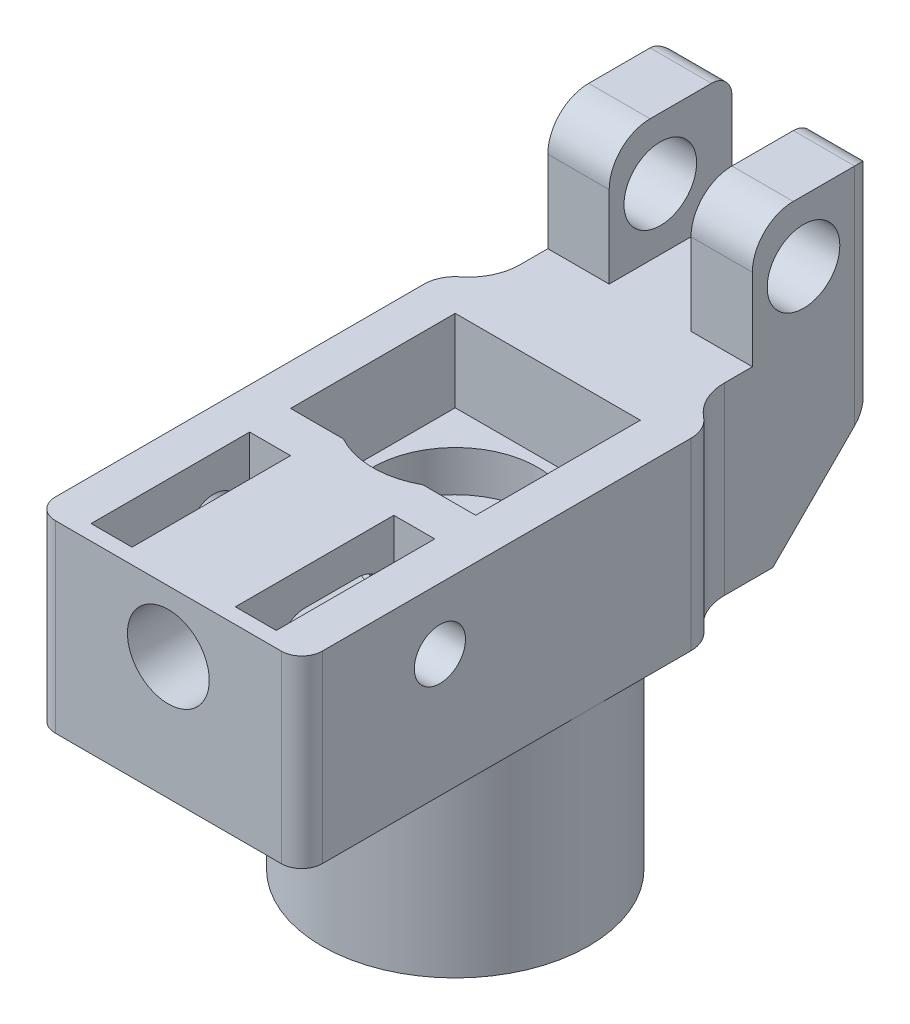
from build123d import *

# Parameters (mm, degrees)
SKETCH1_R               = 13.05
SKETCH1_R_2             = 8.05
BOSS_EXTRUDE1_DEPTH     = 20
SKETCH2_R               = 8.05
BOSS_EXTRUDE2_DEPTH     = 10
SKETCH3_W               = 18.1
SKETCH3_H               = 13
CUT_EXTRUDE1_DEPTH      = 4
SKETCH4_W               = 18.1
SKETCH4_H               = 13
BOSS_EXTRUDE3_DEPTH     = 8
SKETCH5_R               = 8.05
SKETCH5_R_2             = 4
BOSS_EXTRUDE4_DEPTH     = 6
SKETCH10_W              = 10.1
SKETCH10_H              = 13
BOSS_EXTRUDE7_DEPTH     = 12
CUT_EXTRUDE2_REACH      = 59.476
SKETCH6_R               = 4
CUT_EXTRUDE3_DEPTH      = 54.963066195
CUT_EXTRUDE3_DEPTH_BACK = 54.963066195
SKETCH7_R               = 2.5
BOSS_EXTRUDE5_DEPTH     = 10
SKETCH13_W              = 6
SKETCH13_H              = 12
BOSS_EXTRUDE8_DEPTH     = 12
FILLET1_R               = 5
FILLET2_R               = 2
CUT_EXTRUDE4_REACH      = 63.577
CUT_EXTRUDE5_REACH      = 65.209
SKETCH14_R              = 3.55
FILLET4_R               = 4
FILLET5_R               = 2
SKETCH15_W              = 4
SKETCH15_H              = 2.5
CUT_EXTRUDE6_DEPTH      = 12


with BuildPart() as part:
    # Sketch1 → Boss-Extrude1 (new body)
    with BuildSketch(Plane(origin=(0, 0, 0), x_dir=(1, 0, 0), z_dir=(0, 1, 0))):
        with Locations(Location((0, 0, 0), (0, 0, 270))):
            Circle(SKETCH1_R)
        with Locations(Location((0, 0, 0), (0, 0, 270))):
            Circle(SKETCH1_R_2, mode=Mode.SUBTRACT)
    extrude(amount=BOSS_EXTRUDE1_DEPTH)

    # Sketch2 → Boss-Extrude2 (add)
    with BuildSketch(Plane(origin=(0, 20, 0), x_dir=(1, 0, 0), z_dir=(0, 1, 0))):
        with BuildLine():
            Line((-13.05, -13.05), (-13.05, 10))
            ThreePointArc((-13.05, 10), (-12.156675683, 12.156675683), (-10, 13.05))
            Line((-10, 13.05), (10, 13.05))
            ThreePointArc((10, 13.05), (12.156675683, 12.156675683), (13.05, 10))
            Line((13.05, 10), (13.05, -13.05))
            Line((13.05, -13.05), (13.05, -28.05))
            Line((13.05, -28.05), (-13.05, -28.05))
            Line((-13.05, -28.05), (-13.05, -13.05))
        make_face()
        with Locations(Location((0, 0, 0), (0, 0, 270))):
            Circle(SKETCH2_R, mode=Mode.SUBTRACT)
    extrude(amount=BOSS_EXTRUDE2_DEPTH)

    # Sketch3 → Cut-Extrude1 (cut)
    with BuildSketch(Plane(origin=(0, 30, 0), x_dir=(1, 0, 0), z_dir=(0, 1, 0))):
        with Locations((0, -17.55)):
            Rectangle(SKETCH3_W, SKETCH3_H)
    extrude(amount=-CUT_EXTRUDE1_DEPTH, mode=Mode.SUBTRACT)

    # Sketch4 → Boss-Extrude3 (add)
    with BuildSketch(Plane(origin=(0, 30, 0), x_dir=(1, 0, 0), z_dir=(0, 1, 0))):
        with BuildLine():
            Line((-13.05, -28.05), (13.05, -28.05))
            Line((13.05, -28.05), (13.05, 10))
            ThreePointArc((13.05, 10), (12.156675683, 12.156675683), (10, 13.05))
            Line((10, 13.05), (-10, 13.05))
            ThreePointArc((-10, 13.05), (-12.156675683, 12.156675683), (-13.05, 10))
            Line((-13.05, 10), (-13.05, -28.05))
        make_face()
        with BuildLine():
            Line((-9.05, 9.05), (-9.05, -7.05))
            Line((-9.05, -7.05), (-3.885871846, -7.05))
            ThreePointArc((-3.885871846, -7.05), (0, -8.05), (3.885871846, -7.05))
            Line((3.885871846, -7.05), (9.05, -7.05))
            Line((9.05, -7.05), (9.05, 9.05))
            Line((9.05, 9.05), (-9.05, 9.05))
        make_face(mode=Mode.SUBTRACT)
        with Locations((0, -17.55)):
            Rectangle(SKETCH4_W, SKETCH4_H, mode=Mode.SUBTRACT)
    extrude(amount=BOSS_EXTRUDE3_DEPTH)

    # Sketch5 → Boss-Extrude4 (add)
    with BuildSketch(Plane(origin=(0, 20, 0), x_dir=(1, 0, 0), z_dir=(0, 1, 0))):
        with Locations(Location((0, 0, 0), (0, 0, 270))):
            Circle(SKETCH5_R)
        with Locations(Location((0, 0, 0), (0, 0, 270))):
            Circle(SKETCH5_R_2, mode=Mode.SUBTRACT)
    extrude(amount=BOSS_EXTRUDE4_DEPTH)

    # Sketch10 → Boss-Extrude7 (add)
    with BuildSketch(Plane(origin=(0, 26, 0), x_dir=(1, 0, 0), z_dir=(0, 1, 0))):
        with Locations((0, -17.55)):
            Rectangle(SKETCH10_W, SKETCH10_H)
    extrude(amount=BOSS_EXTRUDE7_DEPTH)

    # Cut-Extrude2: up to this face of the body (flat: up to its plane)
    cut_extrude2_end = Plane(part.part.faces().sort_by_distance((-6.467935923, 34, 7.05))[0])
    # Sketch6 → Cut-Extrude2 (cut, up to the picked face)
    with BuildSketch(Plane.XY.offset(28.05), mode=Mode.PRIVATE) as cut_extrude2_sk1:
        with Locations((0, 32)):
            Circle(SKETCH6_R)
    cut_extrude2_tool1 = split(extrude(cut_extrude2_sk1.sketch, amount=-CUT_EXTRUDE2_REACH, mode=Mode.PRIVATE), bisect_by=cut_extrude2_end, keep=Keep.BOTH, mode=Mode.PRIVATE)
    add(cut_extrude2_tool1.solids().sort_by(Axis((0, 32, 28.05), (0, 0, -1)))[0], mode=Mode.SUBTRACT)

    # Sketch7 → Cut-Extrude3 (cut, two sides: drawn at the far end of the back side and taken through both)
    with BuildSketch(Plane(origin=(13.05, 0, 0), x_dir=(0, 0, -1), z_dir=(1, 0, 0)).offset(-CUT_EXTRUDE3_DEPTH_BACK)):
        with Locations((-14.55, 32)):
            Circle(SKETCH7_R)
    extrude(amount=CUT_EXTRUDE3_DEPTH + CUT_EXTRUDE3_DEPTH_BACK, mode=Mode.SUBTRACT)

    # Sketch8 → Boss-Extrude5 (add, symmetric)
    with BuildSketch(Plane(origin=(0, 0, 0), x_dir=(0, 0, -1), z_dir=(1, 0, 0))):
        Polygon((21.05, 20), (31.05, 30), (31.05, 38), (13.05, 38), (13.05, 20), align=None)
    extrude(amount=BOSS_EXTRUDE5_DEPTH, both=True)

    # Sketch13 → Boss-Extrude8 (add)
    with BuildSketch(Plane(origin=(0, 38, 0), x_dir=(1, 0, 0), z_dir=(0, 1, 0))):
        with Locations((-7, 25.05)):
            Rectangle(SKETCH13_W, SKETCH13_H)
        with Locations((7, 25.05)):
            Rectangle(SKETCH13_W, SKETCH13_H)
    extrude(amount=BOSS_EXTRUDE8_DEPTH)

    # Fillet1
    fillet1_edges = [part.edges().sort_by_distance(p)[0] for p in [
        (10, 29, -13.05),
        (-10, 29, -13.05),
    ]]
    fillet(fillet1_edges, radius=FILLET1_R)

    # Fillet2
    fillet2_edges = [part.edges().sort_by_distance(p)[0] for p in [
        (-10, 40, -31.05),
        (10, 40, -31.05),
        (-7, 50, -31.05),
        (7, 50, -31.05),
    ]]
    fillet(fillet2_edges, radius=FILLET2_R)

    # Cut-Extrude4: up to this face of the body (flat: up to its plane)
    cut_extrude4_end = Plane(part.part.faces().sort_by_distance((-5.05, 32, 17.981964525))[0])
    # Sketch11 → Cut-Extrude4 (cut, up to the picked face)
    with BuildSketch(Plane(origin=(5.05, 0, 0), x_dir=(0, 0, -1), z_dir=(1, 0, 0)), mode=Mode.PRIVATE) as cut_extrude4_sk1:
        with BuildLine():
            Line((-19.75, 29.5), (-14.55, 29.5))
            ThreePointArc((-14.55, 29.5), (-12.05, 32), (-14.55, 34.5))
            Line((-14.55, 34.5), (-19.75, 34.5))
            ThreePointArc((-19.75, 34.5), (-22.25, 32), (-19.75, 29.5))
        make_face()
    cut_extrude4_tool1 = split(extrude(cut_extrude4_sk1.sketch, amount=-CUT_EXTRUDE4_REACH, mode=Mode.PRIVATE), bisect_by=cut_extrude4_end, keep=Keep.BOTH, mode=Mode.PRIVATE)
    add(cut_extrude4_tool1.solids().sort_by(Axis((5.05, 32, 17.15), (-1, 0, 0)))[0], mode=Mode.SUBTRACT)

    # Cut-Extrude5: up to this face of the body (flat: up to its plane)
    cut_extrude5_end = Plane(part.part.faces().sort_by_distance((-10, 35.310803733, -22.824229644))[0])
    # Sketch14 → Cut-Extrude5 (cut, up to the picked face)
    with BuildSketch(Plane(origin=(10, 0, 0), x_dir=(0, 0, -1), z_dir=(1, 0, 0)), mode=Mode.PRIVATE) as cut_extrude5_sk1:
        with Locations((24.05, 44)):
            Circle(SKETCH14_R)
    cut_extrude5_tool1 = split(extrude(cut_extrude5_sk1.sketch, amount=-CUT_EXTRUDE5_REACH, mode=Mode.PRIVATE), bisect_by=cut_extrude5_end, keep=Keep.BOTH, mode=Mode.PRIVATE)
    add(cut_extrude5_tool1.solids().sort_by(Axis((10, 44, -24.05), (-1, 0, 0)))[0], mode=Mode.SUBTRACT)

    # Fillet4
    fillet4_edges = [part.edges().sort_by_distance(p)[0] for p in [
        (-7, 50, -19.05),
        (7, 50, -19.05),
    ]]
    fillet(fillet4_edges, radius=FILLET4_R)

    # Fillet5
    fillet5_edges = [part.edges().sort_by_distance(p)[0] for p in [
        (-13.05, 29, 28.05),
        (13.05, 29, 28.05),
    ]]
    fillet(fillet5_edges, radius=FILLET5_R)

    # Sketch15 → Cut-Extrude6 (cut)
    with BuildSketch(Plane(origin=(0, 38, 0), x_dir=(1, 0, 0), z_dir=(0, 1, 0))):
        with Locations((7.05, -25.3)):
            Rectangle(SKETCH15_W, SKETCH15_H)
        with Locations((-7.05, -25.3)):
            Rectangle(SKETCH15_W, SKETCH15_H)
    extrude(amount=-CUT_EXTRUDE6_DEPTH, mode=Mode.SUBTRACT)


solid = part.part
